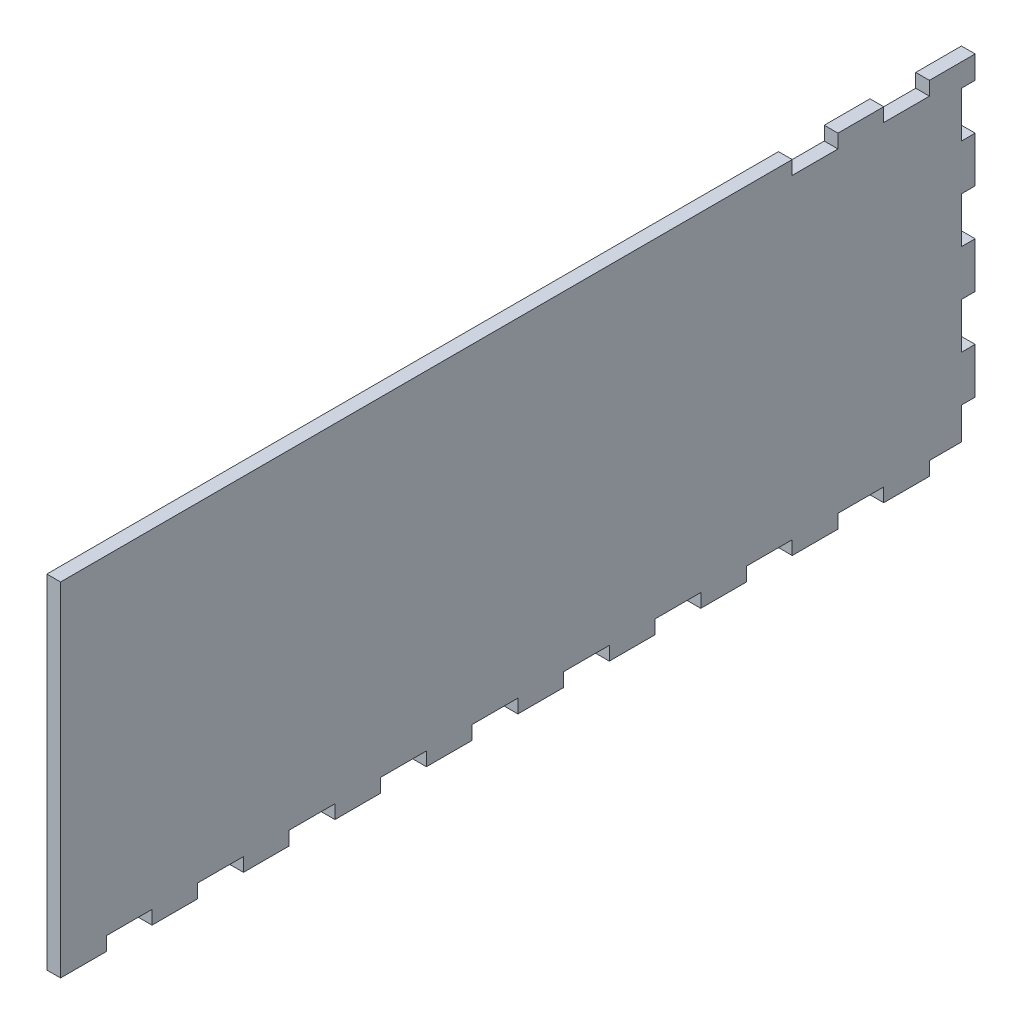
from build123d import *

# Parameters (mm, degrees)
MDFESB_W        = 200
MDFESB_H        = 75
MDF_DEPTH       = 3
ENTRADASESB_W   = 10
ENTRADASESB_H   = 3
ENTRADASESB_W_2 = 3
ENTRADASESB_H_2 = 10
ENTRADAS_DEPTH  = 3


with BuildPart() as part:
    # mdfEsb → mdf (new body)
    with BuildSketch(Plane(origin=(0, 0, 0), x_dir=(0, 0, -1), z_dir=(1, 0, 0))):
        with Locations((100, 37.5)):
            Rectangle(MDFESB_W, MDFESB_H)
    extrude(amount=MDF_DEPTH)

    # entradasEsb → Entradas (cut)
    with BuildSketch(Plane(origin=(3, 0, 0), x_dir=(0, 0, -1), z_dir=(1, 0, 0))):
        with Locations((15, 1.5)):
            Rectangle(ENTRADASESB_W, ENTRADASESB_H)
        with Locations((35, 1.5)):
            Rectangle(ENTRADASESB_W, ENTRADASESB_H)
        with Locations((55, 1.5)):
            Rectangle(ENTRADASESB_W, ENTRADASESB_H)
        with Locations((75, 1.5)):
            Rectangle(ENTRADASESB_W, ENTRADASESB_H)
        with Locations((95, 1.5)):
            Rectangle(ENTRADASESB_W, ENTRADASESB_H)
        with Locations((115, 1.5)):
            Rectangle(ENTRADASESB_W, ENTRADASESB_H)
        with Locations((135, 1.5)):
            Rectangle(ENTRADASESB_W, ENTRADASESB_H)
        with Locations((155, 1.5)):
            Rectangle(ENTRADASESB_W, ENTRADASESB_H)
        with Locations((175, 1.5)):
            Rectangle(ENTRADASESB_W, ENTRADASESB_H)
        with Locations((198.5, 25)):
            Rectangle(ENTRADASESB_W_2, ENTRADASESB_H_2)
        with Locations((198.5, 45)):
            Rectangle(ENTRADASESB_W_2, ENTRADASESB_H_2)
        with Locations((198.5, 65)):
            Rectangle(ENTRADASESB_W_2, ENTRADASESB_H_2)
        Polygon((190, 0), (190, 3), (197, 3), (197, 10), (200, 10), (200, 0), align=None)
        with Locations((185, 73.5)):
            Rectangle(ENTRADASESB_W, ENTRADASESB_H)
        with Locations((165, 73.5)):
            Rectangle(ENTRADASESB_W, ENTRADASESB_H)
    extrude(amount=-ENTRADAS_DEPTH, mode=Mode.SUBTRACT)


solid = part.part
